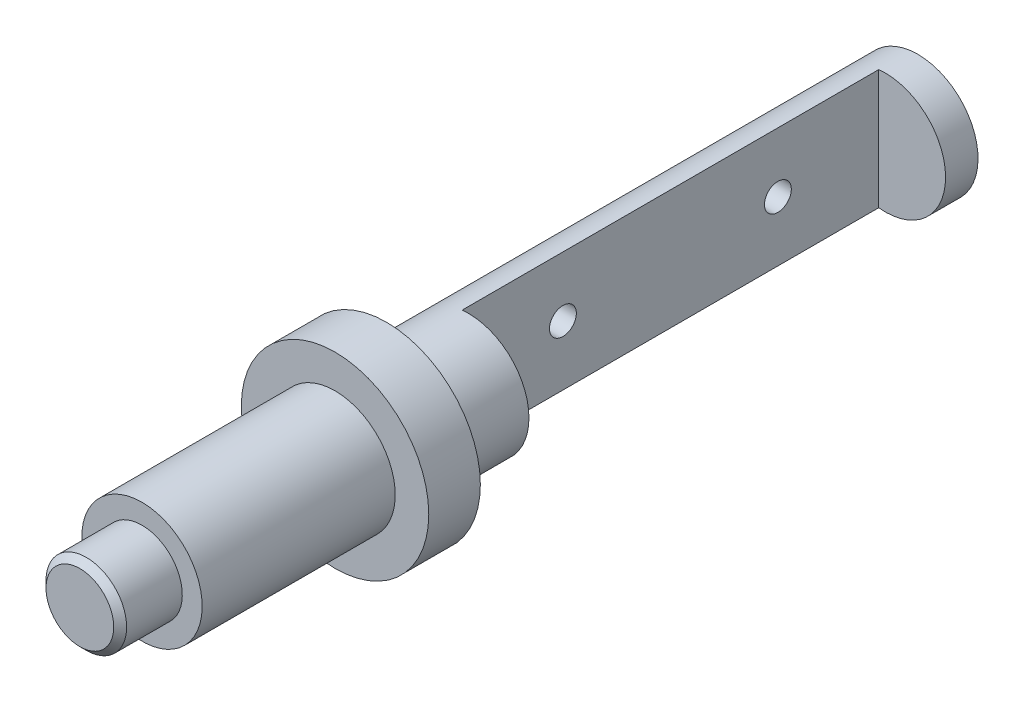
from build123d import *

# Parameters (mm, degrees)
CUT_EXTRUDE1_DEPTH      = 395.646626743
CUT_EXTRUDE1_DEPTH_BACK = 395.646626743
SKETCH2_W               = 31.1
SKETCH2_H               = 193.8
SKETCH3_R               = 6.25
CUT_EXTRUDE2_DEPTH      = 396.001126581
CHAMFER1_SIZE           = 3


with BuildPart() as part:
    # Sketch1 → Revolve1 (revolve)
    with BuildSketch(Plane(origin=(0, 0, 0), x_dir=(0, 0, -1), z_dir=(1, 0, 0))):
        Polygon((0, 0), (0, 18.75), (28.9, 18.75), (28.9, 28), (118.7, 28), (118.7, 43.6), (142.7, 43.6), (142.7, 28), (389.8, 28), (389.8, 0), align=None)
    revolve(axis=Axis((0, 0, -389.8), (0, 0, 1)))

    # Sketch2 → Cut-Extrude1 (cut, two sides: drawn at the far end of the back side and taken through both)
    with BuildSketch(Plane(origin=(0, 0, 0), x_dir=(1, 0, 0), z_dir=(0, 1, 0)).offset(-CUT_EXTRUDE1_DEPTH_BACK)):
        with Locations((12.45, 277.8)):
            Rectangle(SKETCH2_W, SKETCH2_H)
    extrude(amount=CUT_EXTRUDE1_DEPTH + CUT_EXTRUDE1_DEPTH_BACK, mode=Mode.SUBTRACT)

    # Sketch3 → Cut-Extrude2 (cut, through all)
    with BuildSketch(Plane(origin=(-3.1, 0, 0), x_dir=(0, 0, -1), z_dir=(1, 0, 0))):
        with Locations((227.8, 0)):
            Circle(SKETCH3_R)
        with Locations((327.8, 0)):
            Circle(SKETCH3_R)
    extrude(amount=-CUT_EXTRUDE2_DEPTH, mode=Mode.SUBTRACT)

    # Chamfer1
    chamfer1_edges = [part.edges().sort_by_distance(p)[0] for p in [
        (0, -18.75, 0),
    ]]
    chamfer(chamfer1_edges, length=CHAMFER1_SIZE)


solid = part.part
